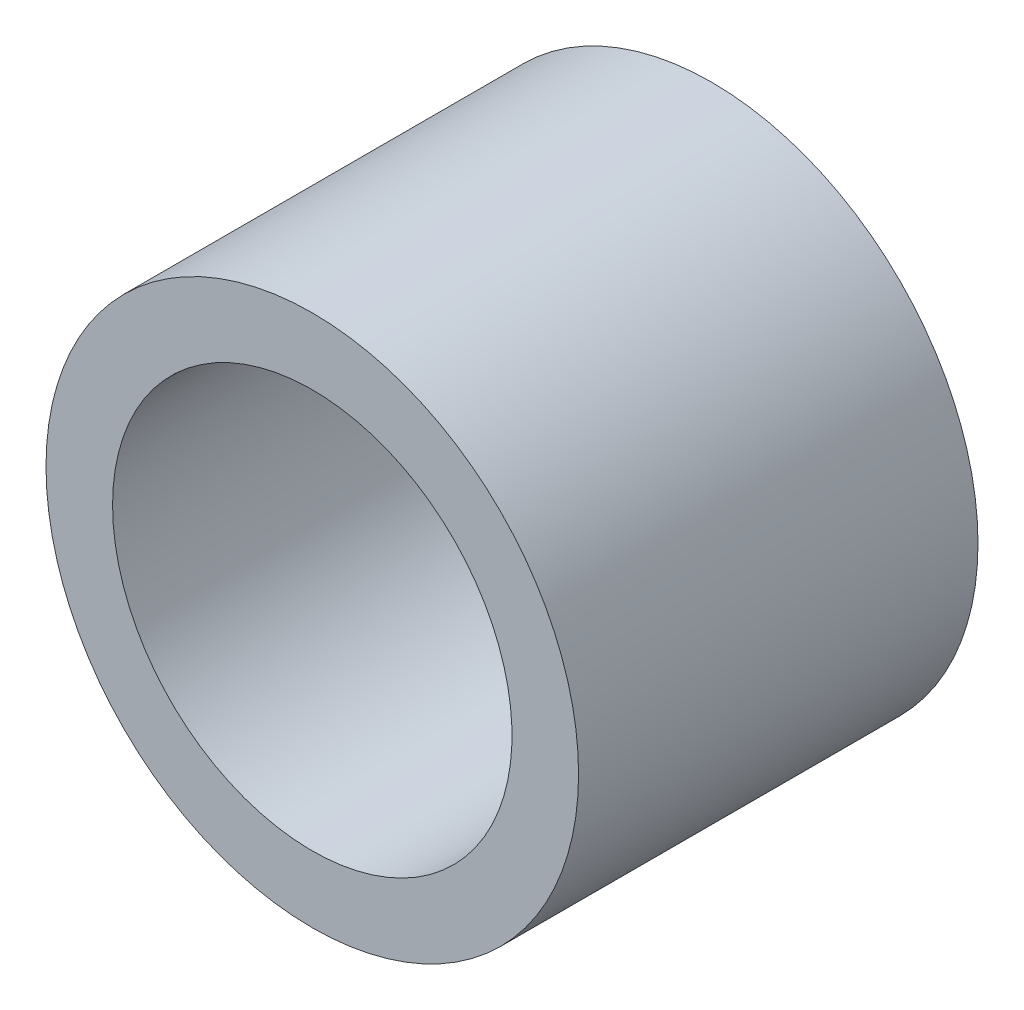
from build123d import *

# Parameters (mm, degrees)
SKETCH1_R           = 6.35
SKETCH1_R_2         = 4.7625
BOSS_EXTRUDE1_DEPTH = 9.525


with BuildPart() as part:
    # Sketch1 → Boss-Extrude1 (new body)
    with BuildSketch(Plane.XY):
        with Locations(Location((0, 0, 0), (0, 0, 180))):
            Circle(SKETCH1_R)
        with Locations(Location((0, 0, 0), (0, 0, 180))):
            Circle(SKETCH1_R_2, mode=Mode.SUBTRACT)
    extrude(amount=BOSS_EXTRUDE1_DEPTH)


solid = part.part
